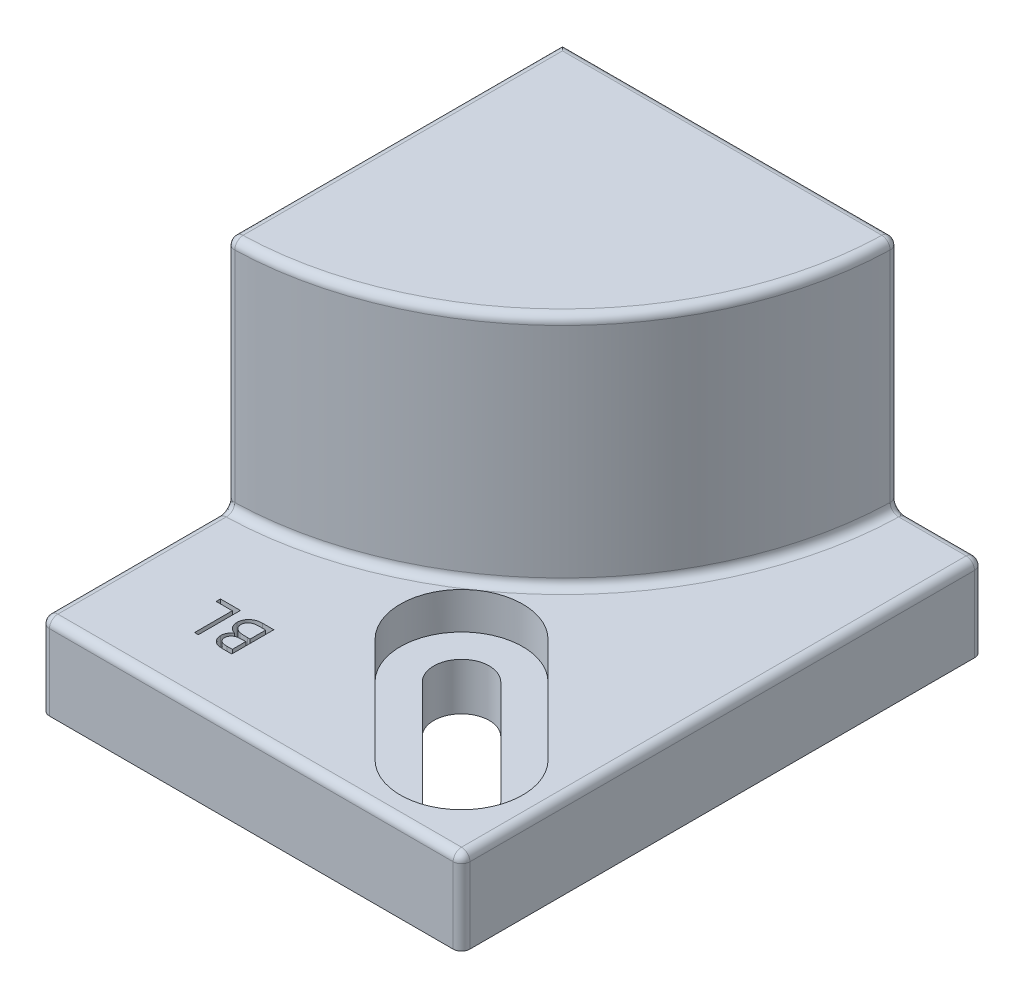
from build123d import *

# Parameters (mm, degrees)
SKETCH3_W                               = 50
SKETCH3_H                               = 62
BOSS_EXTRUDE1_DEPTH                     = 10
CBORE_FOR_M6_HEX_HEAD_BOLT1_D           = 6.6
CBORE_FOR_M6_HEX_HEAD_BOLT1_CBORE_D     = 14.55
CBORE_FOR_M6_HEX_HEAD_BOLT1_CBORE_DEPTH = 4.38
BOSS_EXTRUDE3_DEPTH                     = 18
BOSS_EXTRUDE4_DEPTH                     = 10
SKETCH10_R                              = 3
CUT_EXTRUDE2_DEPTH                      = 6
FILLET1_R                               = 1
CUT_EXTRUDE3_DEPTH                      = 4.38
CUT_EXTRUDE4_DEPTH                      = 52.327033922
CUT_EXTRUDE5_DEPTH                      = 2


with BuildPart() as part:
    # Sketch3 → Boss-Extrude1 (new body)
    with BuildSketch(Plane(origin=(0, 0, 0), x_dir=(1, 0, 0), z_dir=(0, 1, 0))):
        Rectangle(SKETCH3_W, SKETCH3_H)
    extrude(amount=BOSS_EXTRUDE1_DEPTH)

    # CBORE for M6 Hex Head Bolt1 (through all)
    with Locations(Plane(origin=(0, 10, 0), x_dir=(1, 0, 0), z_dir=(0, 1, 0))):
        with Locations((15, -21)):
            CounterBoreHole(CBORE_FOR_M6_HEX_HEAD_BOLT1_D / 2, CBORE_FOR_M6_HEX_HEAD_BOLT1_CBORE_D / 2, CBORE_FOR_M6_HEX_HEAD_BOLT1_CBORE_DEPTH)

    # Sketch8 → Boss-Extrude3 (add)
    with BuildSketch(Plane(origin=(0, 10, 0), x_dir=(1, 0, 0), z_dir=(0, 1, 0))):
        with BuildLine():
            Line((15, 31), (5, 31))
            ThreePointArc((5, 31), (-3.786796564, 9.786796564), (-25, 1))
            Line((-25, 1), (-25, -9))
            ThreePointArc((-25, -9), (3.284271247, 2.715728753), (15, 31))
        make_face()
    extrude(amount=BOSS_EXTRUDE3_DEPTH)

    # Sketch9 → Boss-Extrude4 (add)
    with BuildSketch(Plane(origin=(0, 28, 0), x_dir=(1, 0, 0), z_dir=(0, 1, 0))):
        with BuildLine():
            Line((15, 31), (-25, 31))
            Line((-25, 31), (-25, -9))
            ThreePointArc((-25, -9), (3.284271247, 2.715728753), (15, 31))
        make_face()
    extrude(amount=BOSS_EXTRUDE4_DEPTH)

    # Sketch10 → Cut-Extrude2 (cut)
    with BuildSketch(Plane(origin=(0, 10, 0), x_dir=(1, 0, 0), z_dir=(0, 1, 0))):
        with Locations(Location((-12.5, 18.5, 0), (0, 0, 270))):
            Circle(SKETCH10_R)
    extrude(amount=-CUT_EXTRUDE2_DEPTH, mode=Mode.SUBTRACT)

    # Fillet1
    fillet1_edges = [part.edges().sort_by_distance(p)[0] for p in [
        (-25, 10, -16),
        (0, 10, 31),
        (-10, 10, -31),
        (-25, 10, 20),
        (3.284271247, 10, -2.715728753),
        (-25, 24, 9),
        (15, 24, -31),
        (-3.786796564, 10, -9.786796564),
        (5, 19, -31),
        (-25, 19, -1),
        (-3.786796564, 28, -9.786796564),
        (-25, 28, -16),
        (-10, 28, -31),
        (-25, 38, -11),
        (3.284271247, 38, -2.715728753),
        (-5, 38, -31),
        (25, 10, 0),
        (25, 5, 31),
        (-25, 5, 31),
        (25, 5, -31),
        (20, 10, -31),
    ]]
    fillet(fillet1_edges, radius=FILLET1_R)

    # Sketch12 → Cut-Extrude3 (cut)
    with BuildSketch(Plane(origin=(0, 10, 0), x_dir=(1, 0, 0), z_dir=(0, 1, 0))):
        with BuildLine():
            Line((9.855798167, -26.144201833), (-2.540067973, -13.748335693))
            ThreePointArc((-2.540067973, -13.748335693), (-2.540067973, -3.459932027), (7.748335693, -3.459932027))
            Line((7.748335693, -3.459932027), (20.144201833, -15.855798167))
            ThreePointArc((20.144201833, -15.855798167), (20.144201833, -26.144201833), (9.855798167, -26.144201833))
        make_face()
    extrude(amount=-CUT_EXTRUDE3_DEPTH, mode=Mode.SUBTRACT)

    # Sketch13 → Cut-Extrude4 (cut, through all)
    with BuildSketch(Plane(origin=(0, 5.62, 0), x_dir=(1, 0, 0), z_dir=(0, 1, 0))):
        with BuildLine():
            Line((0.270681482, -10.937586238), (12.666547622, -23.333452378))
            ThreePointArc((12.666547622, -23.333452378), (17.333452378, -23.333452378), (17.333452378, -18.666547622))
            Line((17.333452378, -18.666547622), (4.937586238, -6.270681482))
            ThreePointArc((4.937586238, -6.270681482), (0.270681482, -6.270681482), (0.270681482, -10.937586238))
        make_face()
    extrude(amount=-CUT_EXTRUDE4_DEPTH, mode=Mode.SUBTRACT)

    # Sketch14 → Cut-Extrude5 (cut)
    # profile 1 of 2: a face of its own
    with BuildSketch(Plane(origin=(0, 10, 0), x_dir=(1, 0, 0), z_dir=(0, 1, 0))):
        with BuildLine():
            Line((-9.551282051, -23.770976598), (-10.526842949, -23.770976598))
            add(Edge.make_bspline(
                [(-10.526842949, -23.770976598), (-10.574598671, -23.770729478), (-10.667161145, -23.770250499), (-10.801750113, -23.762649452), (-10.927855298, -23.752544579), (-11.045253859, -23.735594197), (-11.154709689, -23.718018888), (-11.255111582, -23.692222541), (-11.347300529, -23.663729535), (-11.458000584, -23.61988918), (-11.583604966, -23.551804556), (-11.718606174, -23.450828588), (-11.835957461, -23.329766556), (-11.93574084, -23.191806822), (-12.015819125, -23.04003548), (-12.073019317, -22.877717941), (-12.109766899, -22.707585003), (-12.113498649, -22.590943144), (-12.115384615, -22.531994226)],
                knots=[0, 0, 0, 0, 1.00128172, 1.940733171, 2.826250472, 3.653024905, 4.427672124, 5.149348099, 5.824709082, 6.450061444, 7.643590664, 8.808605388, 9.972104426, 11.165284501, 12.367876273, 13.557044126, 14.765369432, 16, 16, 16, 16], degree=3))
            add(Edge.make_bspline(
                [(-12.115384615, -22.531994226), (-12.113844131, -22.476769237), (-12.110816935, -22.368246927), (-12.081243675, -22.210052602), (-12.036603556, -22.058991201), (-11.972185154, -21.916518499), (-11.890046278, -21.783886399), (-11.790111992, -21.663357267), (-11.671617319, -21.557297485), (-11.582650864, -21.498273707), (-11.537459936, -21.468292303)],
                knots=[0, 0, 0, 0, 1.044356178, 2.052258378, 3.035953355, 4.020338374, 5.002448483, 5.980768927, 6.974322109, 8, 8, 8, 8], degree=3))
            add(Edge.make_bspline(
                [(-11.537459936, -21.468292303), (-11.594264578, -21.446494939), (-11.702945929, -21.404791182), (-11.852699045, -21.330773858), (-11.981765045, -21.250885765), (-12.091807236, -21.164541347), (-12.184014817, -21.068921214), (-12.266157032, -20.966543587), (-12.335868605, -20.853843001), (-12.395348131, -20.733261623), (-12.442465366, -20.605438007), (-12.475171279, -20.471328427), (-12.495913473, -20.332451858), (-12.498625893, -20.2380641), (-12.5, -20.190247431)],
                knots=[0, 0, 0, 0, 1.272200328, 2.434034374, 3.488177493, 4.442517805, 5.351202203, 6.260825393, 7.183200622, 8.11705787, 9.069326169, 10.026320267, 11.000137371, 12, 12, 12, 12], degree=3))
            add(Edge.make_bspline(
                [(-12.5, -20.190247431), (-12.498604372, -20.141437695), (-12.495858434, -20.045403172), (-12.475603245, -19.904323248), (-12.441297489, -19.769506158), (-12.394078864, -19.640054502), (-12.332527008, -19.516726439), (-12.25816597, -19.398552749), (-12.16891704, -19.287284782), (-12.068413968, -19.181307905), (-11.956281453, -19.084396628), (-11.832720196, -19.001114264), (-11.700896942, -18.929179863), (-11.559006528, -18.871348638), (-11.408055766, -18.826077368), (-11.248009291, -18.794776886), (-11.078957985, -18.773601913), (-10.96294237, -18.771866552), (-10.903445513, -18.770976598)],
                knots=[0, 0, 0, 0, 0.978522333, 1.925270105, 2.85076145, 3.763600118, 4.682725947, 5.609499657, 6.557784645, 7.537954401, 8.534920712, 9.522742111, 10.520247711, 11.5409147, 12.58930695, 13.675078472, 14.807699069, 16, 16, 16, 16], degree=3))
            Line((-10.903445513, -18.770976598), (-9.551282051, -18.770976598))
            Line((-9.551282051, -18.770976598), (-9.551282051, -23.770976598))
        make_face()
        with BuildLine():
            Line((-10, -23.258156085), (-10, -21.655591982))
            Line((-10, -21.655591982), (-10.301482372, -21.655591982))
            add(Edge.make_bspline(
                [(-10.301482372, -21.655591982), (-10.345552476, -21.656158547), (-10.430704899, -21.657253264), (-10.554346743, -21.660487949), (-10.668828631, -21.66914857), (-10.774545024, -21.678308622), (-10.870787445, -21.692413168), (-10.957877822, -21.709673354), (-11.036599363, -21.727767424), (-11.127338625, -21.758628107), (-11.230252507, -21.803759541), (-11.339193486, -21.875514965), (-11.437245264, -21.958592234), (-11.518132322, -22.057134856), (-11.585473734, -22.163551976), (-11.630812091, -22.27863715), (-11.66242368, -22.398424512), (-11.66523785, -22.481036072), (-11.666666667, -22.522979803)],
                knots=[0, 0, 0, 0, 1.156584208, 2.234756387, 3.244705828, 4.168772894, 5.018724976, 5.795346628, 6.498686023, 7.135894168, 8.308330183, 9.43588092, 10.547699294, 11.667188675, 12.76860303, 13.837480448, 14.902040606, 16, 16, 16, 16], degree=3))
            add(Edge.make_bspline(
                [(-11.666666667, -22.522979803), (-11.66596981, -22.550747468), (-11.664602849, -22.605216777), (-11.651715966, -22.684575431), (-11.633932222, -22.760093506), (-11.604602398, -22.829735171), (-11.569854137, -22.895945829), (-11.525315167, -22.95663401), (-11.473957637, -23.013443766), (-11.414081193, -23.064852363), (-11.345930599, -23.111348471), (-11.267347004, -23.150054262), (-11.180466906, -23.184451626), (-11.083478582, -23.210525634), (-10.978313951, -23.233162023), (-10.863368576, -23.247436405), (-10.739335194, -23.256606493), (-10.653397194, -23.257628033), (-10.608974359, -23.258156085)],
                knots=[0, 0, 0, 0, 0.911412742, 1.787835618, 2.63643285, 3.453173233, 4.262886967, 5.08783453, 5.918594724, 6.773969545, 7.67442701, 8.62112486, 9.645634318, 10.739428598, 11.916091468, 13.177237585, 14.540865421, 16, 16, 16, 16], degree=3))
            Line((-10.608974359, -23.258156085), (-10, -23.258156085))
        make_face(mode=Mode.SUBTRACT)
        with BuildLine():
            Line((-10, -21.142771469), (-10, -19.283797111))
            Line((-10, -19.283797111), (-10.639022436, -19.283797111))
            add(Edge.make_bspline(
                [(-10.639022436, -19.283797111), (-10.684759186, -19.284398036), (-10.772910742, -19.285556239), (-10.900283272, -19.288304497), (-11.017710996, -19.298500525), (-11.126171623, -19.308275847), (-11.225163315, -19.324245866), (-11.315648938, -19.339710355), (-11.395561755, -19.362467114), (-11.489064367, -19.393780818), (-11.593646099, -19.443824267), (-11.707854284, -19.517417445), (-11.808447938, -19.60705936), (-11.893794605, -19.710276936), (-11.964756617, -19.821347685), (-12.013848315, -19.940490215), (-12.04565694, -20.063724971), (-12.04940324, -20.147988377), (-12.051282051, -20.190247431)],
                knots=[0, 0, 0, 0, 1.16016216, 2.236059617, 3.229676189, 4.14889023, 4.996733752, 5.772278665, 6.474820656, 7.101410824, 8.271817372, 9.403828207, 10.537358096, 11.673541442, 12.791884111, 13.865947414, 14.929748409, 16, 16, 16, 16], degree=3))
            add(Edge.make_bspline(
                [(-12.051282051, -20.190247431), (-12.050898528, -20.216670451), (-12.050137668, -20.269090287), (-12.038177709, -20.346055115), (-12.021580344, -20.420978189), (-11.99712049, -20.492841806), (-11.967530718, -20.562883443), (-11.92849427, -20.628824076), (-11.884461445, -20.693470692), (-11.816261259, -20.776160872), (-11.715710785, -20.870283871), (-11.572774738, -20.961284647), (-11.411160183, -21.035862619), (-11.293666801, -21.067390453), (-11.232972756, -21.083676918)],
                knots=[0, 0, 0, 0, 0.723354195, 1.435040621, 2.129761981, 2.824182007, 3.512608497, 4.209435533, 4.920062464, 5.654614313, 7.143585817, 8.671381114, 10.280521501, 12, 12, 12, 12], degree=3))
            add(Edge.make_bspline(
                [(-11.232972756, -21.083676918), (-11.208645499, -21.088613084), (-11.155898988, -21.09931571), (-11.069887722, -21.110606049), (-10.97136436, -21.120733851), (-10.860750009, -21.128028698), (-10.737604741, -21.135859588), (-10.601968117, -21.13879665), (-10.453744249, -21.142381489), (-10.350897877, -21.142638151), (-10.297475962, -21.142771469)],
                knots=[0, 0, 0, 0, 0.634452549, 1.375623993, 2.216454381, 3.166361212, 4.209414599, 5.370755378, 6.634280627, 8, 8, 8, 8], degree=3))
            Line((-10.297475962, -21.142771469), (-10, -21.142771469))
        make_face(mode=Mode.SUBTRACT)
    # profile 2 of 2: a face of its own
    with BuildSketch(Plane(origin=(0, 10, 0), x_dir=(1, 0, 0), z_dir=(0, 1, 0))):
        Polygon((-13.525641026, -23.770976598), (-13.974358974, -23.770976598), (-13.974358974, -19.283797111), (-15.897435897, -19.283797111), (-15.897435897, -18.770976598), (-13.525641026, -18.770976598), align=None)
    extrude(amount=-CUT_EXTRUDE5_DEPTH, mode=Mode.SUBTRACT)


solid = part.part
